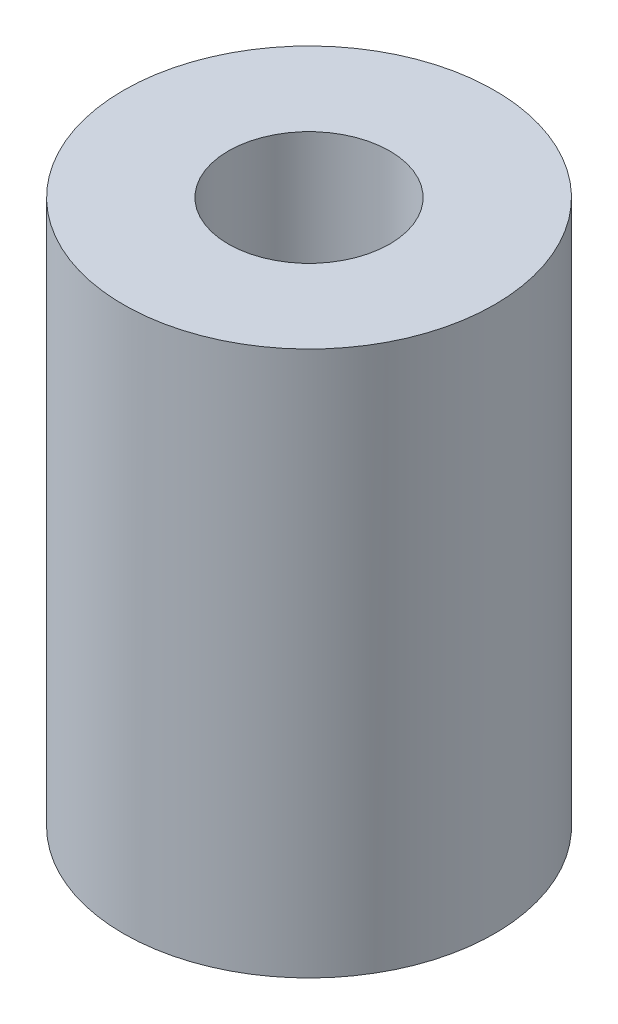
from build123d import *

# Parameters (mm, degrees)
SKETCH_1_R      = 4.6
SKETCH_1_R_2    = 2
EXTRUDE_1_DEPTH = 13.5


with BuildPart() as part:
    # Эскиз1 → Вытянуть1 (new body)
    with BuildSketch(Plane(origin=(0, 0, 0), x_dir=(1, 0, 0), z_dir=(0, 1, 0))):
        with Locations(Location((0, 0, 0), (0, 0, 180))):
            Circle(SKETCH_1_R)
        with Locations(Location((0, 0, 0), (0, 0, 180))):
            Circle(SKETCH_1_R_2, mode=Mode.SUBTRACT)
    extrude(amount=EXTRUDE_1_DEPTH)


solid = part.part
